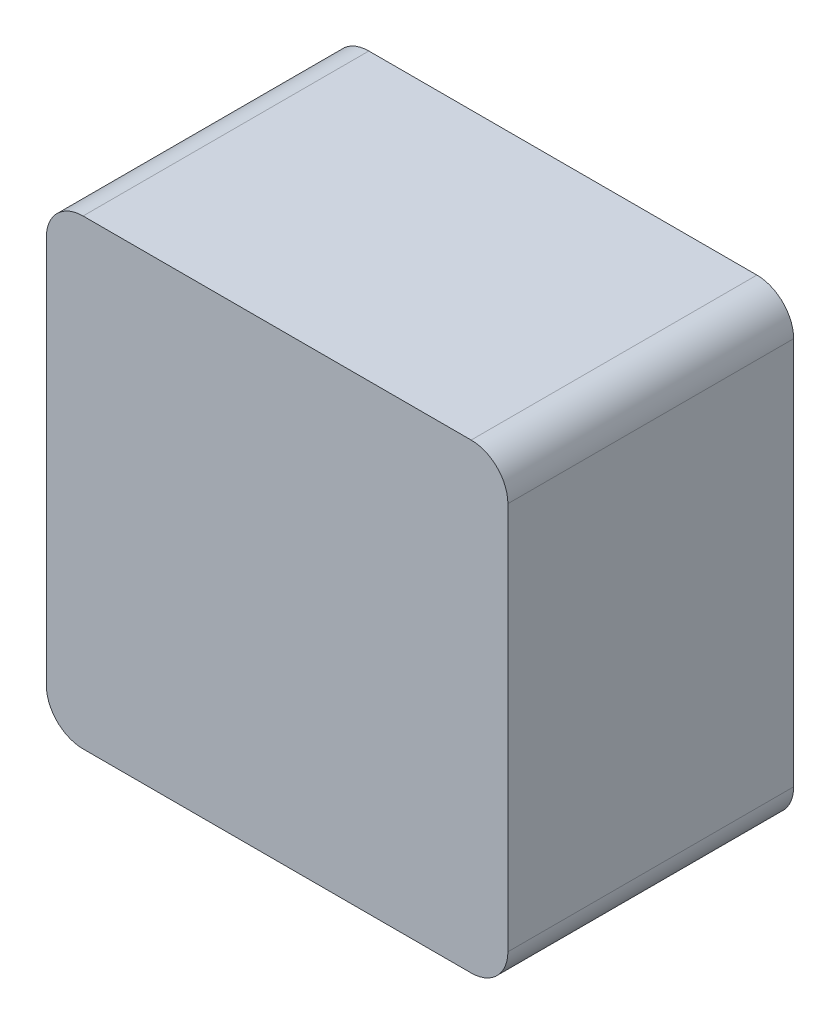
from build123d import *

# Parameters (mm, degrees)
SHELL_WALLS_DEPTH             = 68.58
SHELL_TOP_DEPTH               = 1.42
REAR_COOLING_FAN_CUTOUT_REACH = 146.493
REAR_COOLING_FAN_SKETCH_W     = 5
REAR_COOLING_FAN_SKETCH_H     = 92.06


with BuildPart() as part:
    # Shell → Shell Walls (new body)
    with BuildSketch(Plane.XY):
        with BuildLine():
            Line((-47.53, 56.53), (47.53, 56.53))
            ThreePointArc((47.53, 56.53), (53.893961031, 53.893961031), (56.53, 47.53))
            Line((56.53, 47.53), (56.53, -47.53))
            ThreePointArc((56.53, -47.53), (53.893961031, -53.893961031), (47.53, -56.53))
            Line((47.53, -56.53), (-47.53, -56.53))
            ThreePointArc((-47.53, -56.53), (-53.893961031, -53.893961031), (-56.53, -47.53))
            Line((-56.53, -47.53), (-56.53, 47.53))
            ThreePointArc((-56.53, 47.53), (-53.893961031, 53.893961031), (-47.53, 56.53))
        make_face()
        with BuildLine():
            Line((-47.53, 52.53), (47.53, 52.53))
            ThreePointArc((47.53, 52.53), (51.065533906, 51.065533906), (52.53, 47.53))
            Line((52.53, 47.53), (52.53, -47.53))
            ThreePointArc((52.53, -47.53), (51.065533906, -51.065533906), (47.53, -52.53))
            Line((47.53, -52.53), (-47.53, -52.53))
            ThreePointArc((-47.53, -52.53), (-51.065533906, -51.065533906), (-52.53, -47.53))
            Line((-52.53, -47.53), (-52.53, 47.53))
            ThreePointArc((-52.53, 47.53), (-51.065533906, 51.065533906), (-47.53, 52.53))
        make_face(mode=Mode.SUBTRACT)
    extrude(amount=SHELL_WALLS_DEPTH)

    # Sketch3 → Shell Top (add)
    with BuildSketch(Plane.XY.offset(68.58)):
        with BuildLine():
            Line((-56.53, 47.53), (-56.53, -47.53))
            ThreePointArc((-56.53, -47.53), (-53.893961031, -53.893961031), (-47.53, -56.53))
            Line((-47.53, -56.53), (47.53, -56.53))
            ThreePointArc((47.53, -56.53), (53.893961031, -53.893961031), (56.53, -47.53))
            Line((56.53, -47.53), (56.53, 47.53))
            ThreePointArc((56.53, 47.53), (53.893961031, 53.893961031), (47.53, 56.53))
            Line((47.53, 56.53), (-47.53, 56.53))
            ThreePointArc((-47.53, 56.53), (-53.893961031, 53.893961031), (-56.53, 47.53))
        make_face()
    extrude(amount=SHELL_TOP_DEPTH)

    # Rear-Cooling Fan Sketch → Rear-Cooling Fan Cutout (cut, up to next)
    with BuildSketch(Plane.ZY.offset(56.53), mode=Mode.PRIVATE) as rear_cooling_fan_cutout_sk1:
        with Locations((65.5, 0)):
            Rectangle(REAR_COOLING_FAN_SKETCH_W, REAR_COOLING_FAN_SKETCH_H)
    rear_cooling_fan_cutout_tool1 = extrude(rear_cooling_fan_cutout_sk1.sketch, amount=-REAR_COOLING_FAN_CUTOUT_REACH, mode=Mode.PRIVATE) & part.part
    add(rear_cooling_fan_cutout_tool1.solids().sort_by_distance((-56.53, 0, 65.5))[0], mode=Mode.SUBTRACT)


solid = part.part
